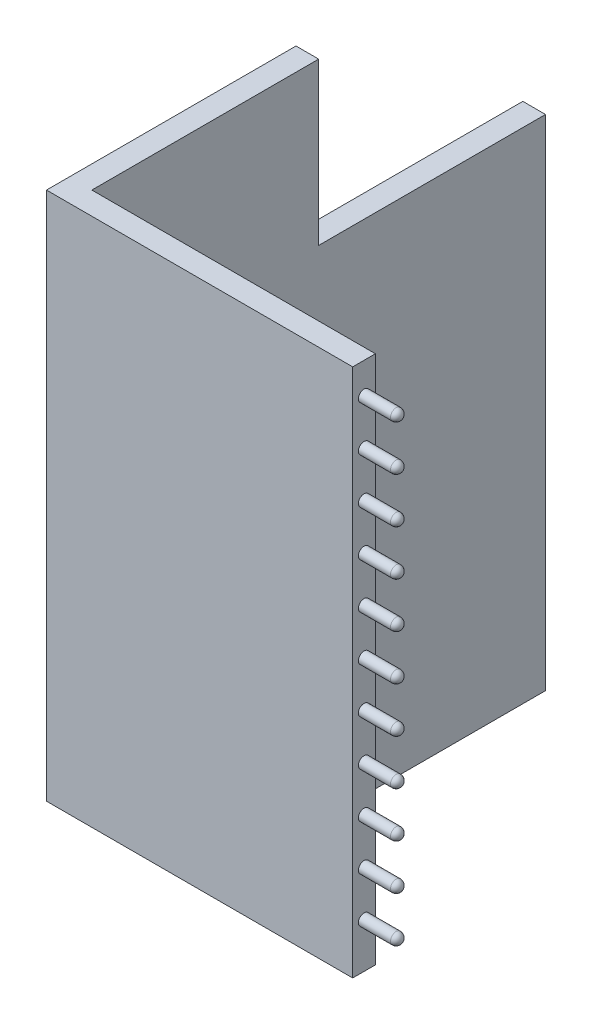
from build123d import *

# Parameters (mm, degrees)
CROQUIS1_W              = 40.5
CROQUIS1_H              = 70
SALIENTE_EXTRUIR1_DEPTH = 3
CROQUIS2_W              = 3
CROQUIS2_H              = 70
SALIENTE_EXTRUIR2_DEPTH = 30
CROQUIS3_R              = 0.75
SALIENTE_EXTRUIR3_DEPTH = 5
REDONDEO5_R             = 0.75
CROQUIS4_W              = 30
CROQUIS4_H              = 66
SALIENTE_EXTRUIR5_DEPTH = 3


with BuildPart() as part:
    # Croquis1 → Saliente-Extruir1 (new body)
    with BuildSketch(Plane.XY):
        Rectangle(CROQUIS1_W, CROQUIS1_H)
    extrude(amount=SALIENTE_EXTRUIR1_DEPTH)

    # Croquis2 → Saliente-Extruir2 (add)
    with BuildSketch(Plane(origin=(0, 0, 0), x_dir=(-1, 0, 0), z_dir=(0, 0, -1))):
        with Locations((18.75, 0)):
            Rectangle(CROQUIS2_W, CROQUIS2_H)
    extrude(amount=SALIENTE_EXTRUIR2_DEPTH)

    # Croquis3 → Saliente-Extruir3 (add)
    with BuildSketch(Plane(origin=(20.25, 0, 0), x_dir=(0, 0, -1), z_dir=(1, 0, 0))):
        with Locations(Location((-1.5, 30.956893841, 0), (0, 0, 270))):
            Circle(CROQUIS3_R)
        with Locations(Location((-1.5, 24.956893841, 0), (0, 0, 270))):
            Circle(CROQUIS3_R)
        with Locations(Location((-1.5, 18.956893841, 0), (0, 0, 270))):
            Circle(CROQUIS3_R)
        with Locations(Location((-1.5, 12.956893841, 0), (0, 0, 270))):
            Circle(CROQUIS3_R)
        with Locations(Location((-1.5, 6.956893841, 0), (0, 0, 270))):
            Circle(CROQUIS3_R)
        with Locations(Location((-1.5, 0.956893841, 0), (0, 0, 270))):
            Circle(CROQUIS3_R)
        with Locations(Location((-1.5, -5.043106159, 0), (0, 0, 90))):
            Circle(CROQUIS3_R)
        with Locations(Location((-1.5, -11.043106159, 0), (0, 0, 270))):
            Circle(CROQUIS3_R)
        with Locations(Location((-1.5, -17.043106159, 0), (0, 0, 270))):
            Circle(CROQUIS3_R)
        with Locations(Location((-1.5, -23.043106159, 0), (0, 0, 270))):
            Circle(CROQUIS3_R)
        with Locations(Location((-1.5, -29.043106159, 0), (0, 0, 270))):
            Circle(CROQUIS3_R)
    extrude(amount=SALIENTE_EXTRUIR3_DEPTH)

    # Redondeo5
    redondeo5_edges = [part.edges().sort_by_distance(p)[0] for p in [
        (25.25, 31.706893841, 1.5),
        (25.25, 25.706893841, 1.5),
        (25.25, 19.706893841, 1.5),
        (25.25, 13.706893841, 1.5),
        (25.25, 7.706893841, 1.5),
        (25.25, 1.706893841, 1.5),
        (25.25, -5.793106159, 1.5),
        (25.25, -10.293106159, 1.5),
        (25.25, -16.293106159, 1.5),
        (25.25, -22.293106159, 1.5),
        (25.25, -28.293106159, 1.5),
    ]]
    fillet(redondeo5_edges, radius=REDONDEO5_R)

    # Croquis4 → Saliente-Extruir5 (add)
    with BuildSketch(Plane(origin=(-17.25, 0, 0), x_dir=(0, 0, -1), z_dir=(1, 0, 0))):
        with Locations((45, -19.34)):
            Rectangle(CROQUIS4_W, CROQUIS4_H)
    extrude(amount=-SALIENTE_EXTRUIR5_DEPTH)


solid = part.part
